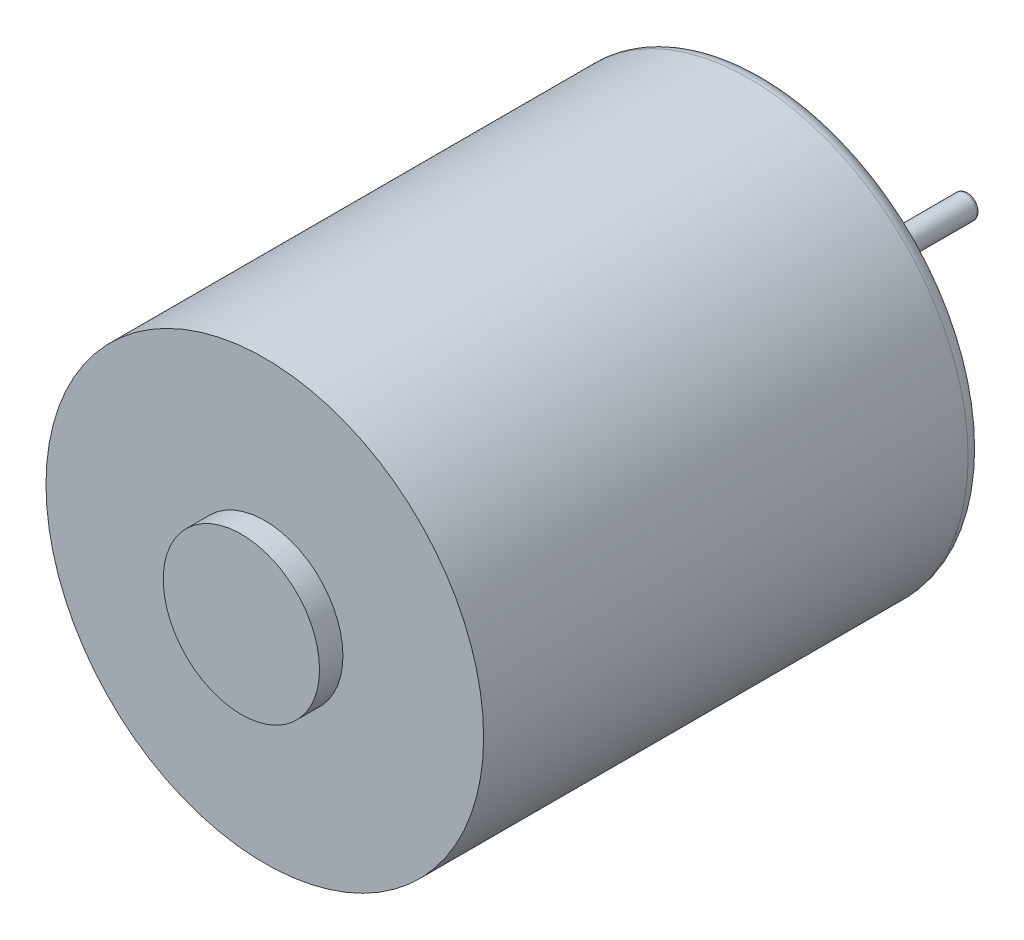
from build123d import *

# Parameters (mm, degrees)
SKETCH1_R           = 14
BOSS_EXTRUDE1_DEPTH = 32
SKETCH2_R           = 5
BOSS_EXTRUDE2_DEPTH = 1.5
BOSS_EXTRUDE3_START = 3.5
SKETCH3_R           = 5
BOSS_EXTRUDE3_DEPTH = 3.5
SKETCH4_R           = 0.75
BOSS_EXTRUDE4_DEPTH = 9.5
SKETCH5_R           = 1
CUT_EXTRUDE1_DEPTH  = 10
FILLET1_R           = 1
FILLET2_R           = 0.2


with BuildPart() as part:
    # Sketch1 → Boss-Extrude1 (new body)
    with BuildSketch(Plane.XY):
        Circle(SKETCH1_R)
    extrude(amount=BOSS_EXTRUDE1_DEPTH)

    # Sketch2 → Boss-Extrude2 (add)
    with BuildSketch(Plane.XY.offset(32)):
        Circle(SKETCH2_R)
    extrude(amount=BOSS_EXTRUDE2_DEPTH)

    # Sketch3 → Boss-Extrude3 (add)
    with BuildSketch(Plane(origin=(0, 0, 0), x_dir=(-1, 0, 0), z_dir=(0, 0, -1)).offset(BOSS_EXTRUDE3_START)):
        with Locations(Location((0, 0, 0), (0, 0, 180))):
            Circle(SKETCH3_R)
    extrude(amount=-BOSS_EXTRUDE3_DEPTH)

    # Sketch4 → Boss-Extrude4 (add)
    with BuildSketch(Plane(origin=(0, 0, -3.5), x_dir=(-1, 0, 0), z_dir=(0, 0, -1))):
        Circle(SKETCH4_R)
    extrude(amount=BOSS_EXTRUDE4_DEPTH)

    # Sketch5 → Cut-Extrude1 (cut)
    with BuildSketch(Plane(origin=(0, 0, 0), x_dir=(-1, 0, 0), z_dir=(0, 0, -1))):
        with Locations((8, 0)):
            Circle(SKETCH5_R)
        with Locations((-8, 0)):
            Circle(SKETCH5_R)
    extrude(amount=-CUT_EXTRUDE1_DEPTH, mode=Mode.SUBTRACT)

    # Fillet1
    fillet1_edges = [part.edges().sort_by_distance(p)[0] for p in [
        (-14, 0, 0),
    ]]
    fillet(fillet1_edges, radius=FILLET1_R)

    # Fillet2
    fillet2_edges = [part.edges().sort_by_distance(p)[0] for p in [
        (0.75, 0, -13),
    ]]
    fillet(fillet2_edges, radius=FILLET2_R)


solid = part.part
